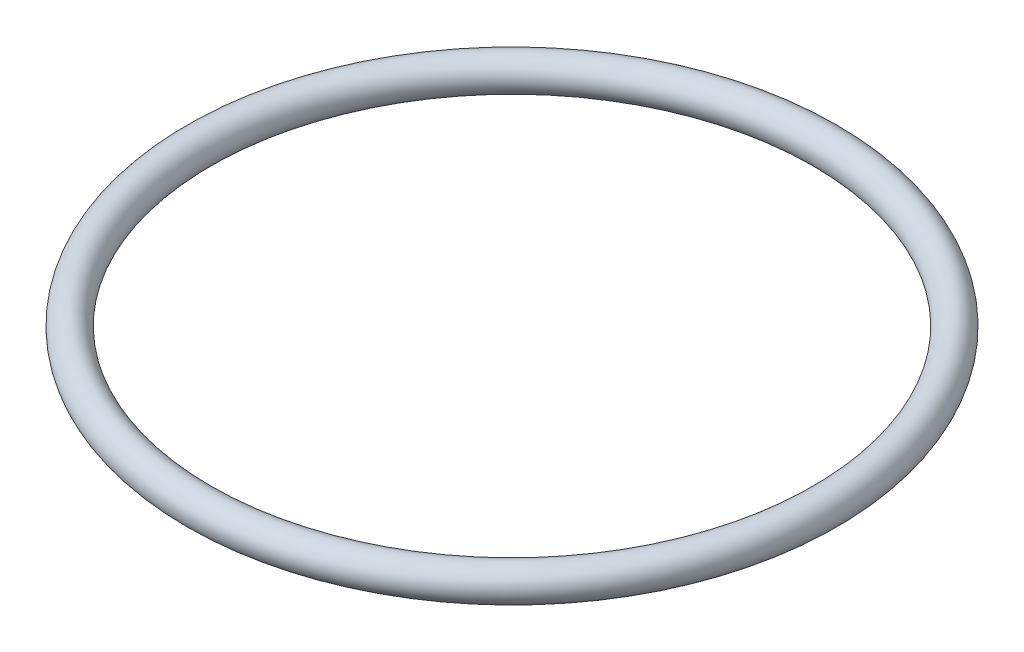
from build123d import *

# Parameters (mm, degrees)
SKETCH1_R = 0.889


with BuildPart() as part:
    # Sketch1 → Revolve1 (revolve)
    with BuildSketch(Plane.XY, mode=Mode.PRIVATE) as revolve1_sk:
        with Locations((16.6243, 0)):
            Circle(SKETCH1_R)
    revolve(revolve1_sk.sketch.rotate(Axis((0, 0, 0), (0, 1, 0)), 90), axis=Axis((0, 0, 0), (0, 1, 0)))


solid = part.part
